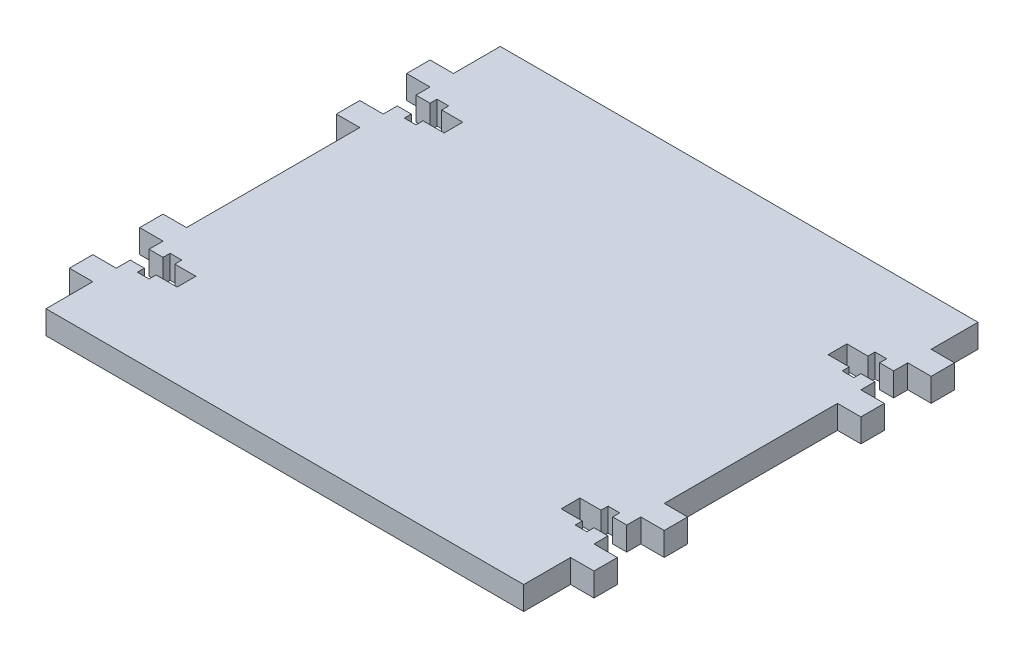
from build123d import *

# Parameters (mm, degrees)
BOSS_EXTRUDE1_DEPTH = 5


with BuildPart() as part:
    # Sketch2 → Boss-Extrude1 (new body)
    with BuildSketch(Plane(origin=(0, 0, 0), x_dir=(1, 0, 0), z_dir=(0, 1, 0))):
        Polygon((125.566090761, 54.865104149), (125.566090761, 51.865104149), (122.566090761, 51.865104149), (122.566090761, 53.365104149), (120.066090761, 53.365104149), (120.066090761, 51.865104149), (115.566090761, 51.865104149), (115.566090761, 47.865104149), (120.066090761, 47.865104149), (120.066090761, 46.365104149), (122.566090761, 46.365104149), (122.566090761, 47.865104149), (125.566090761, 47.865104149), (125.566090761, 44.865104149), (130.566090761, 44.865104149), (130.566090761, 39.865104149), (125.566090761, 39.865104149), (125.566090761, 2.865104149), (130.566090761, 2.865104149), (130.566090761, -2.134895851), (125.566090761, -2.134895851), (125.566090761, -5.134895851), (122.566090761, -5.134895851), (122.566090761, -3.634895851), (120.066090761, -3.634895851), (120.066090761, -5.134895851), (115.566090761, -5.134895851), (115.566090761, -9.134895851), (120.066090761, -9.134895851), (120.066090761, -10.634895851), (122.566090761, -10.634895851), (122.566090761, -9.134895851), (125.566090761, -9.134895851), (125.566090761, -12.134895851), (130.566090761, -12.134895851), (130.566090761, -17.134895851), (125.566090761, -17.134895851), (125.566090761, -27.134895851), (23.566090761, -27.134895851), (23.566090761, -17.134895851), (18.566090761, -17.134895851), (18.566090761, -12.134895851), (23.566090761, -12.134895851), (23.566090761, -9.134895851), (26.566090761, -9.134895851), (26.566090761, -10.634895851), (29.066090761, -10.634895851), (29.066090761, -9.134895851), (33.566090761, -9.134895851), (33.566090761, -5.134895851), (29.066090761, -5.134895851), (29.066090761, -3.634895851), (26.566090761, -3.634895851), (26.566090761, -5.134895851), (23.566090761, -5.134895851), (23.566090761, -2.134895851), (18.566090761, -2.134895851), (18.566090761, 2.865104149), (23.566090761, 2.865104149), (23.566090761, 39.865104149), (18.566090761, 39.865104149), (18.566090761, 44.865104149), (23.566090761, 44.865104149), (23.566090761, 47.865104149), (26.566090761, 47.865104149), (26.566090761, 46.365104149), (29.066090761, 46.365104149), (29.066090761, 47.865104149), (33.566090761, 47.865104149), (33.566090761, 51.865104149), (29.066090761, 51.865104149), (29.066090761, 53.365104149), (26.566090761, 53.365104149), (26.566090761, 51.865104149), (23.566090761, 51.865104149), (23.566090761, 54.865104149), (18.566090761, 54.865104149), (18.566090761, 59.865104149), (23.566090761, 59.865104149), (23.566090761, 69.865104149), (125.566090761, 69.865104149), (125.566090761, 59.865104149), (130.566090761, 59.865104149), (130.566090761, 54.865104149), align=None)
    extrude(amount=BOSS_EXTRUDE1_DEPTH)


solid = part.part
